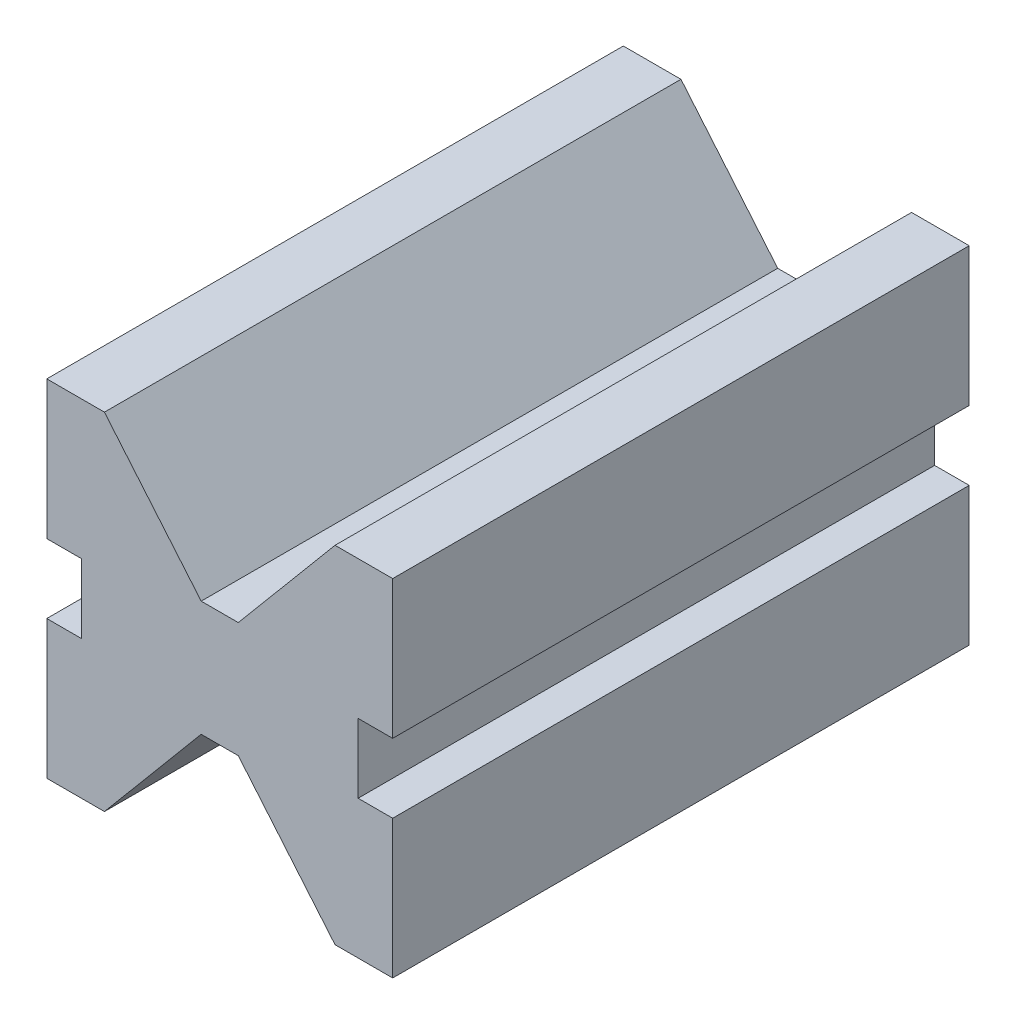
from build123d import *

# Parameters (mm, degrees)
SKETCH_1_W          = 60
SKETCH_1_H          = 60
EXTRUDE_1_DEPTH     = 100
CUT_EXTRUDE_START   = -100
CUT_EXTRUDE_2_DEPTH = 209.627804912
SKETCH_5_W          = 12
SKETCH_5_H          = 12
CUT_EXTRUDE_3_DEPTH = 109.627804912


with BuildPart() as part:
    # 스케치1 → 보스-돌출1 (new body)
    with BuildSketch(Plane.XY):
        Rectangle(SKETCH_1_W, SKETCH_1_H)
    extrude(amount=EXTRUDE_1_DEPTH)

    # 스케치2 → 컷-돌출2 (cut)
    with BuildSketch(Plane.XY.offset(100).offset(CUT_EXTRUDE_START)):
        Polygon((-126.834510501, -157.320411703), (-20, -30), (-3.218007376, -10), (3.218007376, -10), (20, -30), (126.834510501, -157.320411703), (126.834510501, -489.730398739), (-126.834510501, -489.730398739), align=None)
    cut_extrude_2 = extrude(amount=CUT_EXTRUDE_2_DEPTH, mode=Mode.SUBTRACT)

    # 대칭 복사1: 컷-돌출2 across plane
    add(cut_extrude_2.mirror(Plane.ZX), mode=Mode.SUBTRACT)

    # 스케치5 → 컷-돌출3 (cut, through all)
    with BuildSketch(Plane.XY.offset(100)):
        with Locations((30, 0)):
            Rectangle(SKETCH_5_W, SKETCH_5_H)
    cut_extrude_3 = extrude(amount=-CUT_EXTRUDE_3_DEPTH, mode=Mode.SUBTRACT)

    # 대칭 복사2: 컷-돌출3 across plane
    add(cut_extrude_3.mirror(Plane(origin=(0, 0, 0), x_dir=(0, 0, 1), z_dir=(1, 0, 0))), mode=Mode.SUBTRACT)


solid = part.part
